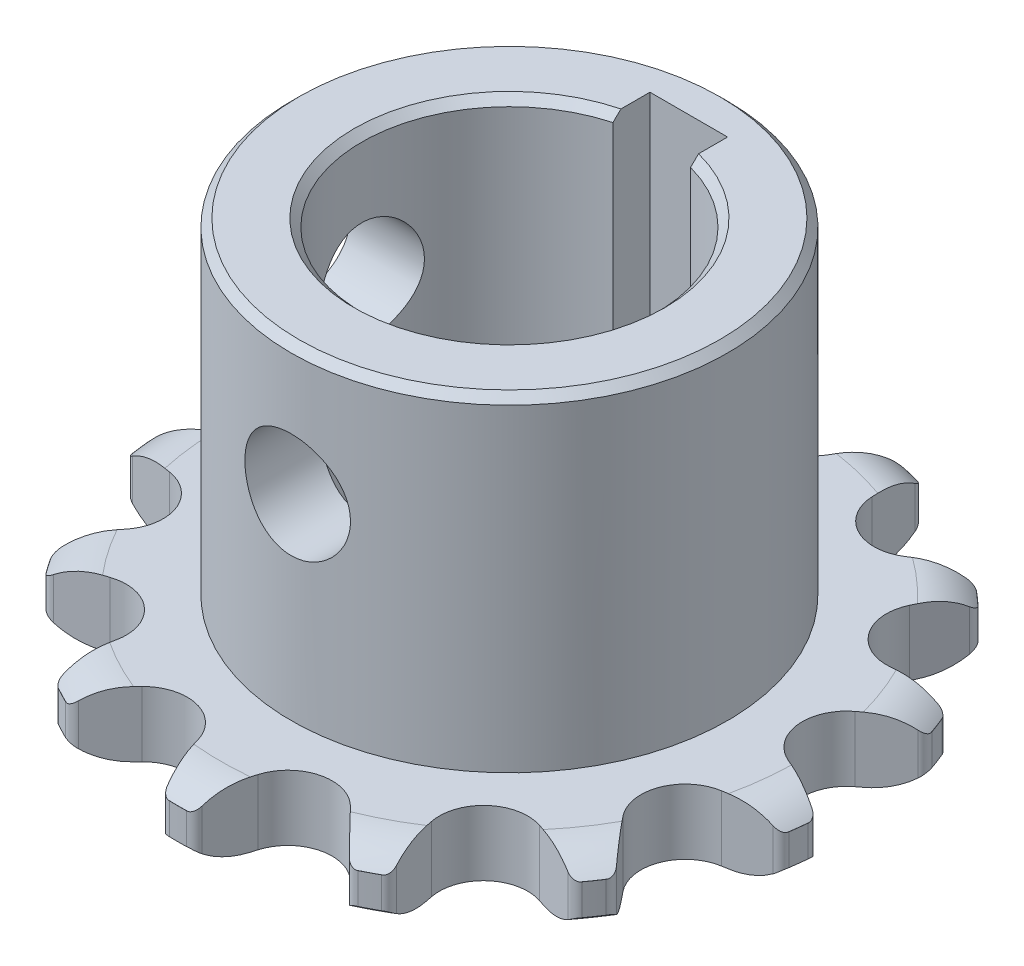
from build123d import *

# Parameters (mm, degrees)
CROQUIS1_R              = 14.05
CROQUIS1_R_2            = 9.5
SALIENTE_EXTRUIR1_DEPTH = 25.2
CROQUIS2_W              = 5
CROQUIS2_H              = 3.820247123
CORTAR_EXTRUIR1_DEPTH   = 33.09119817
CROQUIS4_R              = 3.4
CORTAR_EXTRUIR2_DEPTH   = 33.09119817
CROQUIS5_R              = 3.4
CORTAR_EXTRUIR3_DEPTH   = 33.091198336
CROQUIS6_R              = 21.35
CROQUIS6_R_2            = 12.05
SALIENTE_EXTRUIR2_DEPTH = 4.2
CHAFL_N1_SIZE           = 0.5
CROQUIS8_R              = 2.85
CORTAR_EXTRUIR4_DEPTH   = 37.77832242
CORTAR_EXTRUIR8_DEPTH   = 4.2
REDONDEO3_R             = 0.6


with BuildPart() as part:
    # Croquis1 → Saliente-Extruir1 (new body)
    with BuildSketch(Plane(origin=(0, 0, 0), x_dir=(1, 0, 0), z_dir=(0, 1, 0))):
        with Locations(Location((0, 0, 0), (0, 0, 270))):
            Circle(CROQUIS1_R)
        with Locations(Location((0, 0, 0), (0, 0, 270))):
            Circle(CROQUIS1_R_2, mode=Mode.SUBTRACT)
    extrude(amount=SALIENTE_EXTRUIR1_DEPTH)

    # Croquis2 → Cortar-Extruir1 (cut, through all)
    with BuildSketch(Plane(origin=(0, 25.2, 0), x_dir=(1, 0, 0), z_dir=(0, 1, 0))):
        with Locations((0, 9.639876438)):
            Rectangle(CROQUIS2_W, CROQUIS2_H)
    extrude(amount=-CORTAR_EXTRUIR1_DEPTH, mode=Mode.SUBTRACT)

    # Croquis4 → Cortar-Extruir2 (cut, through all)
    with BuildSketch(Plane.XY):
        with Locations(Location((0, 16.8, 0), (0, 0, 180))):
            Circle(CROQUIS4_R)
    extrude(amount=CORTAR_EXTRUIR2_DEPTH, mode=Mode.SUBTRACT)

    # Croquis5 → Cortar-Extruir3 (cut, through all)
    with BuildSketch(Plane(origin=(0, 0, 0), x_dir=(0, 0, -1), z_dir=(1, 0, 0))):
        with Locations((0, 16.8)):
            Circle(CROQUIS5_R)
    extrude(amount=-CORTAR_EXTRUIR3_DEPTH, mode=Mode.SUBTRACT)

    # Croquis6 → Saliente-Extruir2 (add)
    with BuildSketch(Plane.XZ):
        with Locations(Location((0, 0, 0), (0, 0, 270))):
            Circle(CROQUIS6_R)
        Circle(CROQUIS6_R_2, mode=Mode.SUBTRACT)
    extrude(amount=-SALIENTE_EXTRUIR2_DEPTH)

    # Chaflán1
    chafl_n1_edges = [part.edges().sort_by_distance(p)[0] for p in [
        (0, 25.2, 9.5),
        (0, 0, 9.5),
        (0, 25.2, -14.05),
    ]]
    chamfer(chafl_n1_edges, length=CHAFL_N1_SIZE)

    # Croquis8 → Cortar-Extruir4 (cut, through all)
    with BuildSketch(Plane(origin=(0, 4.2, 0), x_dir=(1, 0, 0), z_dir=(0, 1, 0))):
        with Locations((0, 19.5)):
            Circle(CROQUIS8_R)
        with Locations((9.062101855, 17.2663925)):
            Circle(CROQUIS8_R)
        with Locations((16.048185385, 11.077262561)):
            Circle(CROQUIS8_R)
        with Locations((19.357823045, 2.350465265)):
            Circle(CROQUIS8_R)
        with Locations((18.232816732, -6.914795297)):
            Circle(CROQUIS8_R)
        with Locations((12.930891836, -14.595959589)):
            Circle(CROQUIS8_R)
        with Locations((4.666655454, -18.93336544)):
            Circle(CROQUIS8_R)
        with Locations((-4.666655454, -18.93336544)):
            Circle(CROQUIS8_R)
        with Locations((-12.930891836, -14.595959589)):
            Circle(CROQUIS8_R)
        with Locations((-18.232816732, -6.914795297)):
            Circle(CROQUIS8_R)
        with Locations((-19.357823045, 2.350465265)):
            Circle(CROQUIS8_R)
        with Locations((-16.048185385, 11.077262561)):
            Circle(CROQUIS8_R)
        with Locations((-9.062101855, 17.2663925)):
            Circle(CROQUIS8_R)
    extrude(amount=-CORTAR_EXTRUIR4_DEPTH, mode=Mode.SUBTRACT)

    # Croquis9 → Cortar-Extruir8 (cut)
    with BuildSketch(Plane(origin=(0, 4.2, 0), x_dir=(1, 0, 0), z_dir=(0, 1, 0))):
        with BuildLine():
            Line((2.465457444, 18.070307868), (4.13310933, 20.946119146))
            Line((4.13310933, 20.946119146), (3.63310933, 21.846119146))
            Line((3.63310933, 21.846119146), (2.265253649, 21.229487179))
            ThreePointArc((2.265253649, 21.229487179), (2.844294349, 19.680248876), (2.465457444, 18.070307868))
        make_face()
        with BuildLine():
            Line((6.07446037, 20.46761909), (6.214636643, 17.146218191))
            ThreePointArc((6.214636643, 17.146218191), (6.627370115, 18.747804446), (7.860052129, 19.850493206))
            Line((7.860052129, 19.850493206), (6.57446037, 21.215950567))
            Line((6.57446037, 21.215950567), (6.07446037, 20.46761909))
        make_face()
        with BuildLine():
            Line((13.369356335, 17.655387742), (13.393833493, 16.626115733))
            Line((13.393833493, 16.626115733), (10.580744942, 14.854707783))
            ThreePointArc((10.580744942, 14.854707783), (11.664365254, 16.104185462), (11.871617116, 17.745061483))
            Line((11.871617116, 17.745061483), (13.369356335, 17.655387742))
        make_face()
        with BuildLine():
            Line((15.680939396, 15.730487192), (16.184714689, 13.923990463))
            ThreePointArc((16.184714689, 13.923990463), (14.580783953, 13.520463952), (13.471032369, 12.294136561))
            Line((13.471032369, 12.294136561), (14.890444405, 15.300234162))
            Line((14.890444405, 15.300234162), (15.680939396, 15.730487192))
        make_face()
        with BuildLine():
            Line((20.042844921, 9.420019778), (19.586191815, 8.497269573))
            Line((19.586191815, 8.497269573), (16.272111285, 8.236073164))
            ThreePointArc((16.272111285, 8.236073164), (17.812270651, 8.838847235), (18.758336171, 10.195456052))
            Line((18.758336171, 10.195456052), (20.042844921, 9.420019778))
        make_face()
        with BuildLine():
            Line((21.195104182, 6.641358774), (20.801654161, 4.807669308))
            ThreePointArc((20.801654161, 4.807669308), (19.193915906, 5.195748107), (17.641376923, 4.625616405))
            Line((17.641376923, 4.625616405), (20.295207076, 6.627749976))
            Line((20.295207076, 6.627749976), (21.195104182, 6.641358774))
        make_face()
        with BuildLine():
            Line((22.124759278, -0.973361194), (21.291589632, -1.578198644))
            Line((21.291589632, -1.578198644), (18.235733034, -0.269346562))
            ThreePointArc((18.235733034, -0.269346562), (19.879599503, -0.451364374), (21.34774647, 0.310194508))
            Line((21.34774647, 0.310194508), (22.124759278, -0.973361194))
        make_face()
        with BuildLine():
            Line((21.853726028, -3.969224902), (20.653185351, -5.410030947))
            ThreePointArc((20.653185351, -5.410030947), (19.409953036, -4.319251015), (17.770294625, -4.102576725))
            Line((17.770294625, -4.102576725), (21.05058239, -3.563071857))
            Line((21.05058239, -3.563071857), (21.853726028, -3.969224902))
        make_face()
        with BuildLine():
            Line((19.138157917, -11.143756847), (18.119340855, -11.29212057))
            Line((18.119340855, -11.29212057), (16.021768108, -8.713062236))
            ThreePointArc((16.021768108, -8.713062236), (17.392751683, -9.638173845), (19.046645322, -9.646128859))
            Line((19.046645322, -9.646128859), (19.138157917, -11.143756847))
        make_face()
        with BuildLine():
            Line((17.505922607, -13.670506987), (15.773320675, -14.38835831))
            ThreePointArc((15.773320675, -14.38835831), (15.179403841, -12.844761781), (13.828251984, -11.890918968))
            Line((13.828251984, -11.890918968), (16.983522965, -12.937636867))
            Line((16.983522965, -12.937636867), (17.505922607, -13.670506987))
        make_face()
        with BuildLine():
            Line((11.767235217, -18.761252103), (10.796169451, -18.419153759))
            Line((10.796169451, -18.419153759), (10.137409193, -15.160720356))
            ThreePointArc((10.137409193, -15.160720356), (10.921434059, -16.61699384), (12.382187268, -17.392640354))
            Line((12.382187268, -17.392640354), (11.767235217, -18.761252103))
        make_face()
        with BuildLine():
            Line((9.147723287, -20.240040669), (7.279978322, -20.070486183))
            ThreePointArc((7.279978322, -20.070486183), (7.471436158, -18.42769242), (6.718323463, -16.955194977))
            Line((6.718323463, -16.955194977), (9.025743102, -19.348345186))
            Line((9.025743102, -19.348345186), (9.147723287, -20.240040669))
        make_face()
        with BuildLine():
            Line((1.700580739, -22.0807706), (0.999725733, -21.326580796))
            Line((0.999725733, -21.326580796), (1.930692, -18.135240149))
            ThreePointArc((1.930692, -18.135240149), (1.948147509, -19.789060803), (2.881119332, -21.154707547))
            Line((2.881119332, -21.154707547), (1.700580739, -22.0807706))
        make_face()
        with BuildLine():
            Line((-1.306109197, -22.172824953), (-2.881119332, -21.154707547))
            ThreePointArc((-2.881119332, -21.154707547), (-1.948147509, -19.789060803), (-1.930692, -18.135240149))
            Line((-1.930692, -18.135240149), (-0.999725733, -21.326580796))
            Line((-0.999725733, -21.326580796), (-1.306109197, -22.172824953))
        make_face()
        with BuildLine():
            Line((-8.755656291, -20.341850654), (-9.025743102, -19.348345186))
            Line((-9.025743102, -19.348345186), (-6.718323463, -16.955194977))
            ThreePointArc((-6.718323463, -16.955194977), (-7.471436158, -18.42769242), (-7.279978322, -20.070486183))
            Line((-7.279978322, -20.070486183), (-8.755656291, -20.341850654))
        make_face()
        with BuildLine():
            Line((-11.460727804, -19.026082251), (-12.382187268, -17.392640354))
            ThreePointArc((-12.382187268, -17.392640354), (-10.921434059, -16.61699384), (-10.137409193, -15.160720356))
            Line((-10.137409193, -15.160720356), (-10.796169451, -18.419153759))
            Line((-10.796169451, -18.419153759), (-11.460727804, -19.026082251))
        make_face()
        with BuildLine():
            Line((-17.206077983, -13.94285787), (-16.983522965, -12.937636867))
            Line((-16.983522965, -12.937636867), (-13.828251984, -11.890918968))
            ThreePointArc((-13.828251984, -11.890918968), (-15.179403841, -12.844761781), (-15.773320675, -14.38835831))
            Line((-15.773320675, -14.38835831), (-17.206077983, -13.94285787))
        make_face()
        with BuildLine():
            Line((-18.989831788, -11.520693395), (-19.046645322, -9.646128859))
            ThreePointArc((-19.046645322, -9.646128859), (-17.392751683, -9.638173845), (-16.021768108, -8.713062236))
            Line((-16.021768108, -8.713062236), (-18.119340855, -11.29212057))
            Line((-18.119340855, -11.29212057), (-18.989831788, -11.520693395))
        make_face()
        with BuildLine():
            Line((-21.714794565, -4.349724377), (-21.05058239, -3.563071857))
            Line((-21.05058239, -3.563071857), (-17.770294625, -4.102576725))
            ThreePointArc((-17.770294625, -4.102576725), (-19.409953036, -4.319251015), (-20.653185351, -5.410030947))
            Line((-20.653185351, -5.410030947), (-21.714794565, -4.349724377))
        make_face()
        with BuildLine():
            Line((-22.168594161, -1.376052521), (-21.34774647, 0.310194508))
            ThreePointArc((-21.34774647, 0.310194508), (-19.879599503, -0.451364374), (-18.235733034, -0.269346562))
            Line((-18.235733034, -0.269346562), (-21.291589632, -1.578198644))
            Line((-21.291589632, -1.578198644), (-22.168594161, -1.376052521))
        make_face()
        with BuildLine():
            Line((-21.248913403, 6.239878551), (-20.295207076, 6.627749976))
            Line((-20.295207076, 6.627749976), (-17.641376923, 4.625616405))
            ThreePointArc((-17.641376923, 4.625616405), (-19.193915906, 5.195748107), (-20.801654161, 4.807669308))
            Line((-20.801654161, 4.807669308), (-21.248913403, 6.239878551))
        make_face()
        with BuildLine():
            Line((-20.268798773, 9.083825402), (-18.758336171, 10.195456052))
            ThreePointArc((-18.758336171, 10.195456052), (-17.812270651, 8.838847235), (-16.272111285, 8.236073164))
            Line((-16.272111285, 8.236073164), (-19.586191815, 8.497269573))
            Line((-19.586191815, 8.497269573), (-20.268798773, 9.083825402))
        make_face()
        with BuildLine():
            Line((-15.915162258, 15.400000501), (-14.890444405, 15.300234162))
            Line((-14.890444405, 15.300234162), (-13.471032369, 12.294136561))
            ThreePointArc((-13.471032369, 12.294136561), (-14.580783953, 13.520463952), (-16.184714689, 13.923990463))
            Line((-16.184714689, 13.923990463), (-15.915162258, 15.400000501))
        make_face()
        with BuildLine():
            Line((-13.725665851, 17.462708397), (-11.871617116, 17.745061483))
            ThreePointArc((-11.871617116, 17.745061483), (-11.664365254, 16.104185462), (-10.580744942, 14.854707783))
            Line((-10.580744942, 14.854707783), (-13.393833493, 16.626115733))
            Line((-13.393833493, 16.626115733), (-13.725665851, 17.462708397))
        make_face()
        with BuildLine():
            Line((-6.935439238, 21.032167927), (-6.07446037, 20.46761909))
            Line((-6.07446037, 20.46761909), (-6.214636643, 17.146218191))
            ThreePointArc((-6.214636643, 17.146218191), (-6.627370115, 18.747804446), (-7.860052129, 19.850493206))
            Line((-7.860052129, 19.850493206), (-6.935439238, 21.032167927))
        make_face()
        with BuildLine():
            Line((-4.038148295, 21.841095347), (-2.265253649, 21.229487179))
            ThreePointArc((-2.265253649, 21.229487179), (-2.844294349, 19.680248876), (-2.465457444, 18.070307868))
            Line((-2.465457444, 18.070307868), (-4.13310933, 20.946119146))
            Line((-4.13310933, 20.946119146), (-4.038148295, 21.841095347))
        make_face()
    extrude(amount=-CORTAR_EXTRUIR8_DEPTH, mode=Mode.SUBTRACT)

    # Redondeo3
    redondeo3_edges = [part.edges().sort_by_distance(p)[0] for p in [
        (6.07446037, 2.1, -20.46761909),
        (13.393833493, 2.1, -16.626115733),
        (14.890444405, 2.1, -15.300234162),
        (19.586191815, 2.1, -8.497269573),
        (20.295207076, 2.1, -6.627749976),
        (21.291589632, 2.1, 1.578198644),
        (21.05058239, 2.1, 3.563071857),
        (18.119340855, 2.1, 11.29212057),
        (16.983522965, 2.1, 12.937636867),
        (10.796169451, 2.1, 18.419153759),
        (9.025743102, 2.1, 19.348345186),
        (0.999725733, 2.1, 21.326580796),
        (-0.999725733, 2.1, 21.326580796),
        (-9.025743102, 2.1, 19.348345186),
        (-10.796169451, 2.1, 18.419153759),
        (-16.983522965, 2.1, 12.937636867),
        (-18.119340855, 2.1, 11.29212057),
        (-21.05058239, 2.1, 3.563071857),
        (-21.291589632, 2.1, 1.578198644),
        (-20.295207076, 2.1, -6.627749976),
        (-6.07446037, 2.1, -20.46761909),
        (-13.393833493, 2.1, -16.626115733),
        (-14.890444405, 2.1, -15.300234162),
        (-19.586191815, 2.1, -8.497269573),
        (-4.13310933, 2.1, -20.946119146),
        (4.13310933, 2.1, -20.946119146),
    ]]
    fillet(redondeo3_edges, radius=REDONDEO3_R)

    # Croquis10 → Cortar-Revolución1 (revolve, cut)
    with BuildSketch(Plane(origin=(0, 0, 0), x_dir=(0, 0, -1), z_dir=(1, 0, 0)), mode=Mode.PRIVATE) as cortar_revoluci_n1_sk:
        with BuildLine():
            Line((-21.442634444, 0), (-18.587638982, 0))
            ThreePointArc((-18.587638982, 0), (-20.070878679, 0.285164876), (-21.342634444, 1.1))
            Line((-21.342634444, 1.1), (-21.442634444, 1.1))
            Line((-21.442634444, 1.1), (-21.442634444, 0))
        make_face()
        with BuildLine():
            Line((-21.442634444, 4.2), (-18.587638982, 4.2))
            ThreePointArc((-18.587638982, 4.2), (-20.070878679, 3.914835124), (-21.342634444, 3.1))
            Line((-21.342634444, 3.1), (-21.442634444, 3.1))
            Line((-21.442634444, 3.1), (-21.442634444, 4.2))
        make_face()
    revolve(cortar_revoluci_n1_sk.sketch.rotate(Axis((0, 0, 0), (0, 1, 0)), 180), axis=Axis((0, 0, 0), (0, 1, 0)), mode=Mode.SUBTRACT)


solid = part.part
